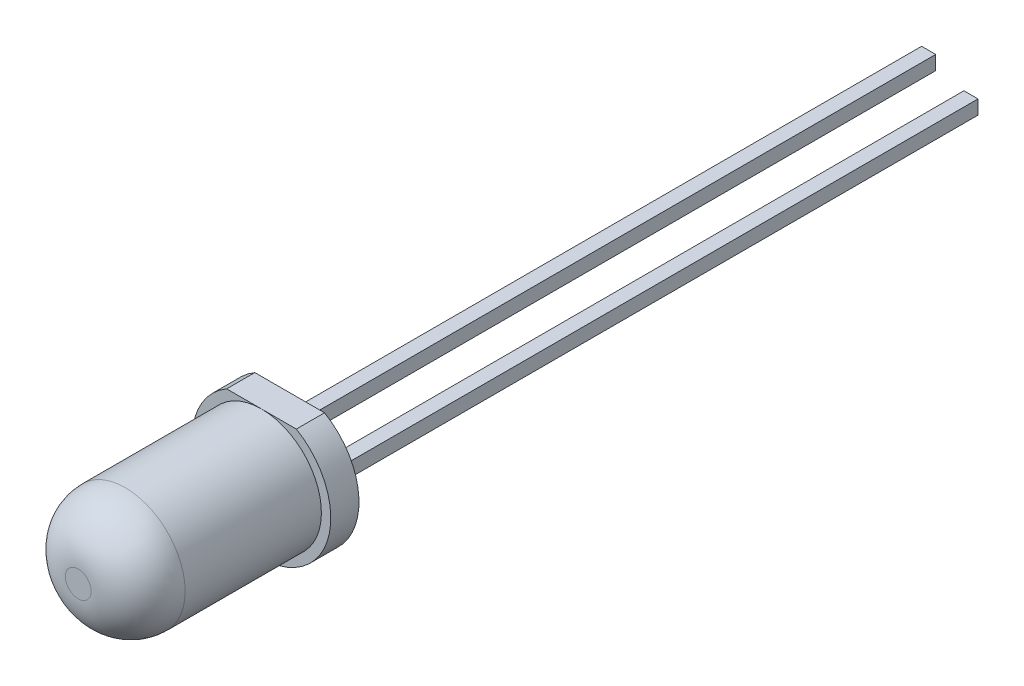
from build123d import *

# Parameters (mm, degrees)
SZKIC2_R                         = 2.95
DODANIE_WYCI_GNI_CIE1_DEPTH      = 1.2
SZKIC3_R                         = 2.55
DODANIE_WYCI_GNI_CIE2_DEPTH      = 7.8
ZAOKR_GLENIE2_R                  = 2
SZKIC4_W                         = 4.283554882
SZKIC4_H                         = 0.750281293
WYTNIJ_WYCI_GNI_CIE1_DEPTH       = 7.8
DODANIE_WYCI_GNI_CIE5_DEPTH      = 0.25
DODANIE_WYCI_GNI_CIE5_DEPTH_BACK = 0.25
SZKIC6_W                         = 0.2
SZKIC6_H                         = 1
SZKIC7_W                         = 0.6
SZKIC7_H                         = 0.6
DODANIE_WYCI_GNI_CIE6_DEPTH      = 29
SZKIC8_W                         = 0.861364308
SZKIC8_H                         = 0.90651153
WYTNIJ_WYCI_GNI_CIE2_DEPTH       = 1.8


with BuildPart() as part:
    # Szkic2 → Dodanie-wyciągnięcie1 (new body)
    with BuildSketch(Plane.XY):
        Circle(SZKIC2_R)
    extrude(amount=DODANIE_WYCI_GNI_CIE1_DEPTH)

    # Szkic3 → Dodanie-wyciągnięcie2 (add)
    with BuildSketch(Plane.XY.offset(1.2)):
        Circle(SZKIC3_R)
    extrude(amount=DODANIE_WYCI_GNI_CIE2_DEPTH)

    # Zaokrąglenie2
    zaokr_glenie2_edges = [part.edges().sort_by_distance(p)[0] for p in [
        (-2.55, 0, 9),
    ]]
    fillet(zaokr_glenie2_edges, radius=ZAOKR_GLENIE2_R)

    # Szkic4 → Wytnij-wyciągnięcie1 (cut)
    with BuildSketch(Plane.XY.offset(1.2)):
        with Locations((0, 2.925140647)):
            Rectangle(SZKIC4_W, SZKIC4_H)
    extrude(amount=-WYTNIJ_WYCI_GNI_CIE1_DEPTH, mode=Mode.SUBTRACT)

    # Szkic7 → Dodanie-wyciągnięcie6 (add)
    with BuildSketch(Plane(origin=(0, 0, 0), x_dir=(-1, 0, 0), z_dir=(0, 0, -1))):
        with Locations((0, 1.27)):
            Rectangle(SZKIC7_W, SZKIC7_H)
        with Locations((0, -1.27)):
            Rectangle(SZKIC7_W, SZKIC7_H)
    extrude(amount=DODANIE_WYCI_GNI_CIE6_DEPTH)

    # Szkic8 → Wytnij-wyciągnięcie2 (cut)
    with BuildSketch(Plane(origin=(0, 0, -29), x_dir=(-1, 0, 0), z_dir=(0, 0, -1))):
        with Locations((0, 1.341985324)):
            Rectangle(SZKIC8_W, SZKIC8_H)
    extrude(amount=-WYTNIJ_WYCI_GNI_CIE2_DEPTH, mode=Mode.SUBTRACT)


with BuildPart() as body_2:
    # Szkic6 → Dodanie-wyciągnięcie5 (new, two sides: drawn at the far end of the back side and taken through both)
    with BuildSketch(Plane(origin=(0, 0, 0), x_dir=(0, 0, -1), z_dir=(1, 0, 0)).offset(-DODANIE_WYCI_GNI_CIE5_DEPTH_BACK)):
        with Locations((-3.2, 0)):
            Rectangle(SZKIC6_W, SZKIC6_H)
    extrude(amount=DODANIE_WYCI_GNI_CIE5_DEPTH + DODANIE_WYCI_GNI_CIE5_DEPTH_BACK)


solid = Compound([part.part, body_2.part])
